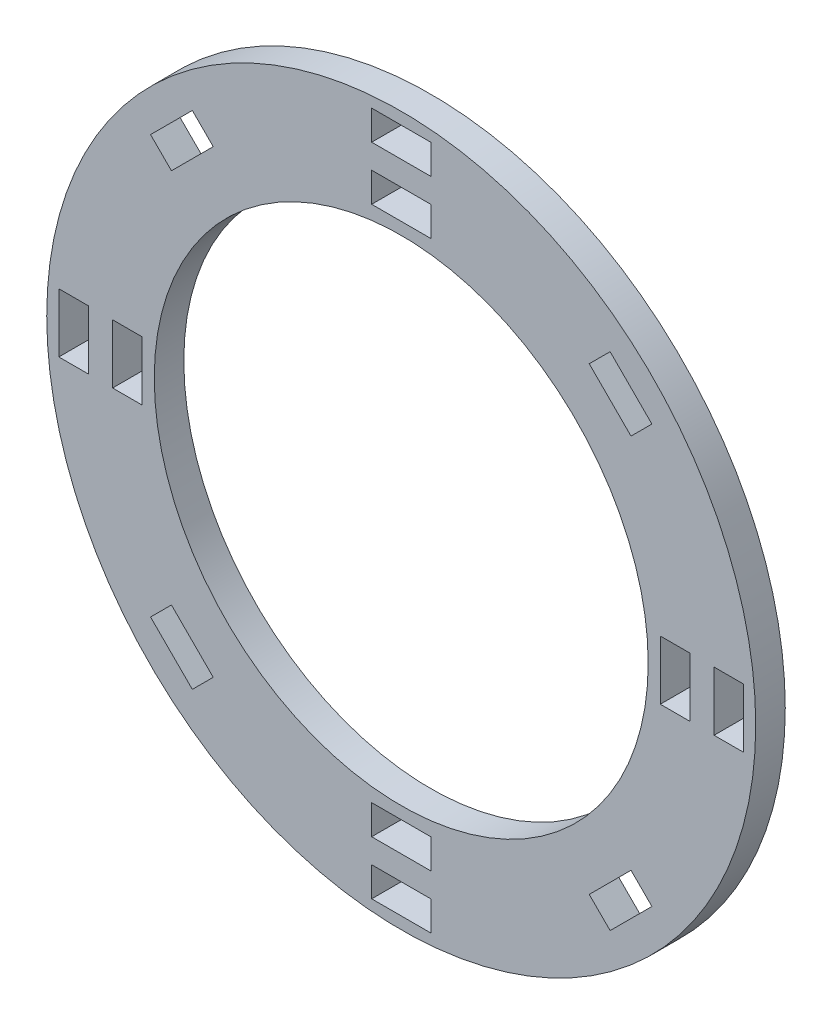
from build123d import *

# Parameters (mm, degrees)
SKETCH1_R           = 76.2
SKETCH1_R_2         = 53.086
BOSS_EXTRUDE2_DEPTH = 6.35
CUT_EXTRUDE1_REACH  = 109.95
SKETCH2_W           = 12.7
SKETCH2_H           = 6.35
CIRPATTERN1_COUNT   = 4
SPACER_HOLES_REACH  = 109.95
CIRPATTERN2_COUNT   = 4


with BuildPart() as part:
    # Sketch1 → Boss-Extrude2 (new body)
    with BuildSketch(Plane.XY):
        Circle(SKETCH1_R)
        Circle(SKETCH1_R_2, mode=Mode.SUBTRACT)
    extrude(amount=BOSS_EXTRUDE2_DEPTH)

    # Sketch2 → Cut-Extrude1 (cut, up to next)
    with BuildSketch(Plane.XY.offset(6.35), mode=Mode.PRIVATE) as cut_extrude1_sk1:
        with Locations((0, 70.4215)):
            Rectangle(SKETCH2_W, SKETCH2_H)
    cut_extrude1_tool1 = extrude(cut_extrude1_sk1.sketch, amount=-CUT_EXTRUDE1_REACH, mode=Mode.PRIVATE) & part.part
    # Sketch2 → Cut-Extrude1 (cut, up to next)
    with BuildSketch(Plane.XY.offset(6.35), mode=Mode.PRIVATE) as cut_extrude1_sk2:
        with Locations((0, 58.8645)):
            Rectangle(SKETCH2_W, SKETCH2_H)
    cut_extrude1_tool2 = extrude(cut_extrude1_sk2.sketch, amount=-CUT_EXTRUDE1_REACH, mode=Mode.PRIVATE) & part.part
    cut_extrude1_1 = cut_extrude1_tool1.solids().sort_by_distance((0, 70.4215, 6.35))[0]
    add(cut_extrude1_1, mode=Mode.SUBTRACT)
    cut_extrude1_2 = cut_extrude1_tool2.solids().sort_by_distance((0, 58.8645, 6.35))[0]
    add(cut_extrude1_2, mode=Mode.SUBTRACT)
    cut_extrude1 = cut_extrude1_1 + cut_extrude1_2  # Cut-Extrude1 as one shape, for the pattern or mirror that repeats it

    # CirPattern1: Cut-Extrude1 ×4 about axis
    cirpattern1_axis = Axis((0, 0, 0), (0, 0, 1))
    for i in range(1, CIRPATTERN1_COUNT):
        add(cut_extrude1.rotate(cirpattern1_axis, i * 360 / CIRPATTERN1_COUNT), mode=Mode.SUBTRACT)

    # Sketch3 → Spacer Holes (cut, up to next)
    with BuildSketch(Plane.XY.offset(6.35), mode=Mode.PRIVATE) as spacer_holes_sk1:
        Polygon((40.411152545, 49.391408666), (44.901280605, 53.881536726), (53.881536726, 44.901280605), (49.391408666, 40.411152545), align=None)
    spacer_holes_tool1 = extrude(spacer_holes_sk1.sketch, amount=-SPACER_HOLES_REACH, mode=Mode.PRIVATE) & part.part
    spacer_holes = spacer_holes_tool1.solids().sort_by_distance((47.146345, 47.146345, 6.35))[0]
    add(spacer_holes, mode=Mode.SUBTRACT)

    # CirPattern2: Spacer Holes ×4 about axis
    cirpattern2_axis = Axis((0, 0, 0), (0, 0, 1))
    for i in range(1, CIRPATTERN2_COUNT):
        add(spacer_holes.rotate(cirpattern2_axis, i * 360 / CIRPATTERN2_COUNT), mode=Mode.SUBTRACT)


solid = part.part
